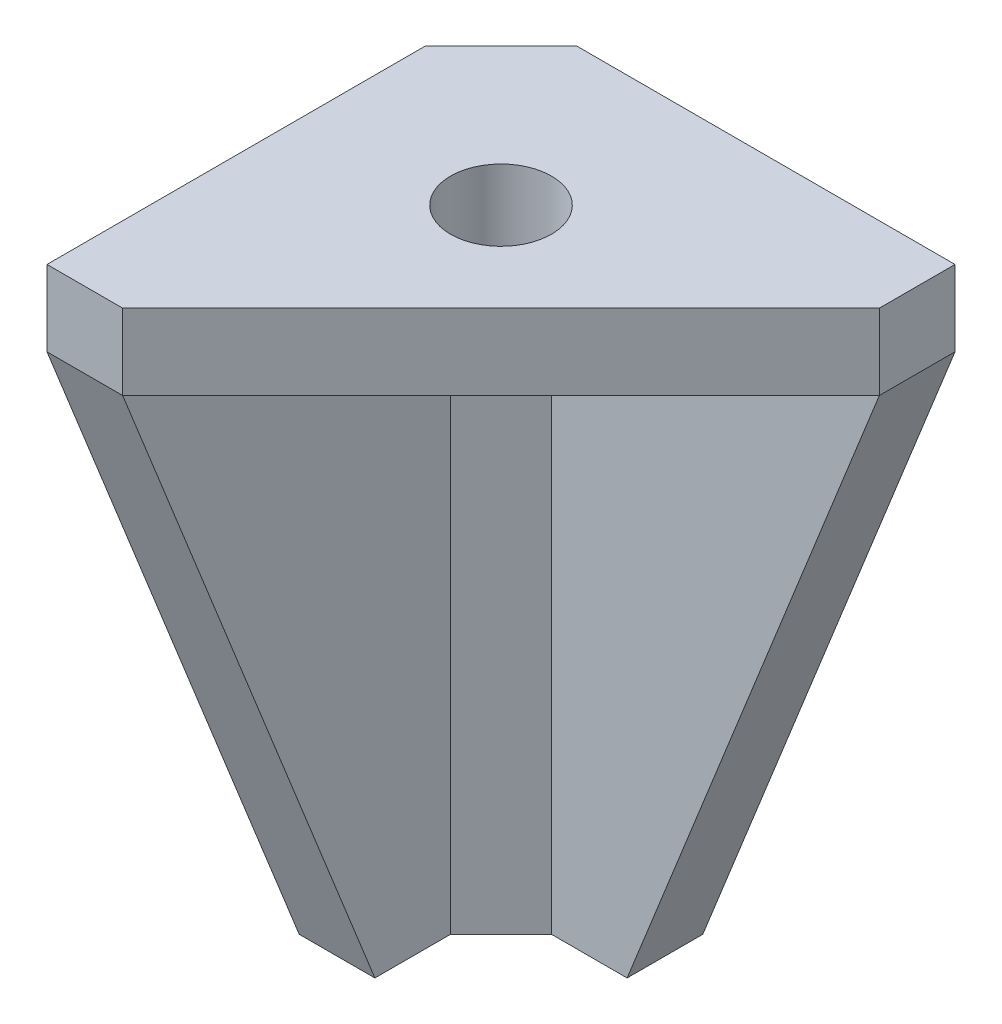
from build123d import *

# Parameters (mm, degrees)
BOSS_EXTRUDE1_DEPTH      = 3
BOSS_EXTRUDE2_DEPTH      = 25
BOSS_EXTRUDE3_DEPTH      = 3
F_4_0_4_DIAMETER_HOLE1_D = 4
CHAMFER2_SIZE            = 2


with BuildPart() as part:
    # Sketch1 → Boss-Extrude1 (new body)
    with BuildSketch(Plane.XY):
        Polygon((-2.5, 12.5), (-2.5, -12.5), (2.5, -12.5), (12.5, 12.5), align=None)
    extrude(amount=BOSS_EXTRUDE1_DEPTH)


with BuildPart() as body_2:
    # Mirror3: mirrored copy
    add(part.part.mirror(Plane(origin=(-2.75, 0, 2.75), x_dir=(0.7071067811865465, 0, 0.7071067811865486), z_dir=(-0.7071067811865488, 0, 0.7071067811865464))))


with BuildPart() as part_1:
    add(part.part)

    add(body_2.part)  # Boss-Extrude2 merges body 2
    # Sketch3 → Boss-Extrude2 (add, through all)
    with BuildSketch(Plane(origin=(0, 12.5, 0), x_dir=(1, 0, 0), z_dir=(0, 1, 0))):
        Polygon((-5.5, -3), (-2.5, 0), (-2.5, -3), align=None)
    extrude(amount=-BOSS_EXTRUDE2_DEPTH)

    # Sketch5 → Boss-Extrude3 (add)
    with BuildSketch(Plane(origin=(0, 12.5, 0), x_dir=(1, 0, 0), z_dir=(0, 1, 0))):
        Polygon((-2.5, -18), (12.5, -3), (12.5, 0), (-2.5, 0), (-5.5, -3), (-5.5, -18), align=None)
    extrude(amount=BOSS_EXTRUDE3_DEPTH)

    # Ø4.0 (4) Diameter Hole1 (through all)
    with Locations(Plane(origin=(0, 15.5, 0), x_dir=(1, 0, 0), z_dir=(0, 1, 0))):
        with Locations((1.464466094, -6.964466094)):
            Hole(F_4_0_4_DIAMETER_HOLE1_D / 2)

    # Chamfer2
    chamfer2_edges = [part_1.edges().sort_by_distance(p)[0] for p in [
        (-2.5, 0, 3),
    ]]
    chamfer(chamfer2_edges, length=CHAMFER2_SIZE)


solid = part_1.part
